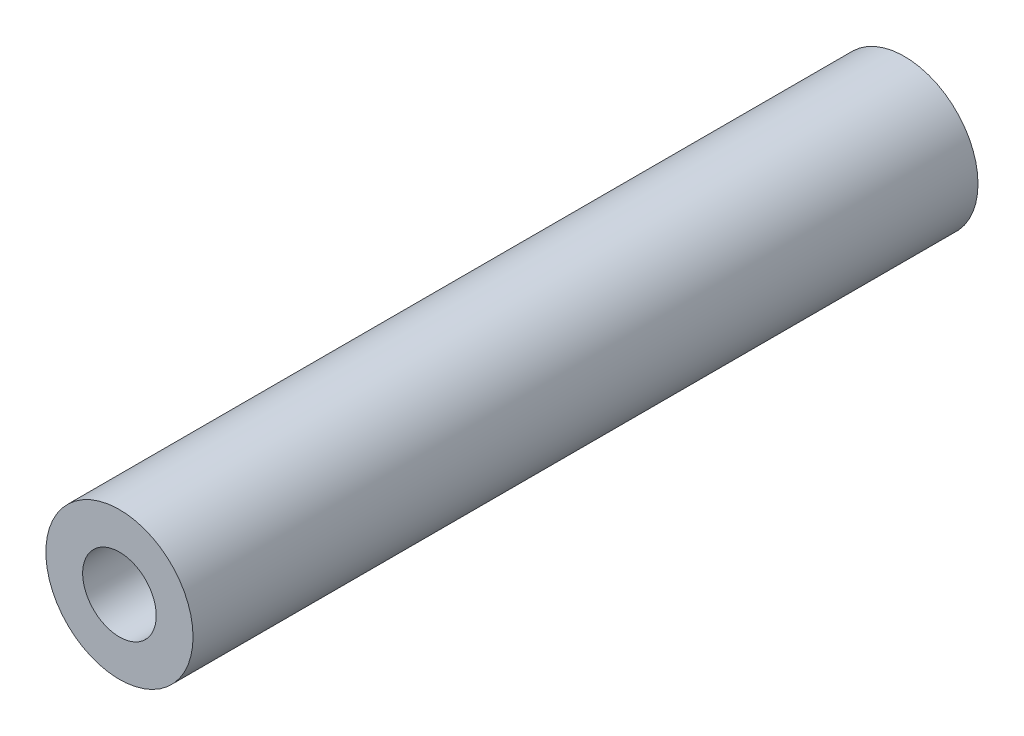
from build123d import *

# Parameters (mm, degrees)
SKETCH_1_R      = 3
SKETCH_1_R_2    = 1.5
EXTRUDE_1_DEPTH = 32


with BuildPart() as part:
    # ｽｹｯﾁ1 → ﾎﾞｽ - 押し出し1 (new body)
    with BuildSketch(Plane.XY):
        Circle(SKETCH_1_R)
        Circle(SKETCH_1_R_2, mode=Mode.SUBTRACT)
    extrude(amount=EXTRUDE_1_DEPTH)


solid = part.part
